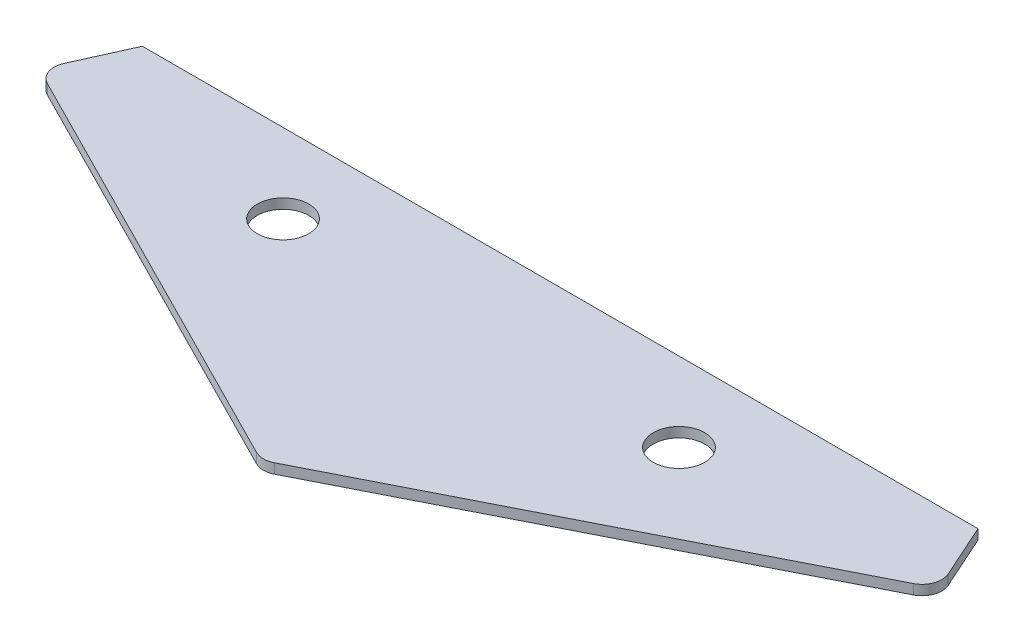
from build123d import *

# Parameters (mm, degrees)
BOSS_EXTRUDE1_DEPTH = 5
SKETCH2_R           = 13
CUT_EXTRUDE1_DEPTH  = 5


with BuildPart() as part:
    # Sketch1 → Boss-Extrude1 (new body)
    with BuildSketch(Plane(origin=(0, 0, 0), x_dir=(1, 0, 0), z_dir=(0, 1, 0))):
        with BuildLine():
            Line((248.032931618, 52.593341059), (260.305567907, 25.2785247))
            ThreePointArc((260.305567907, 25.2785247), (260.612237386, 17.847313664), (255.703480887, 12.259733394))
            Line((255.703480887, 12.259733394), (41.520626689, -96.255259938))
            ThreePointArc((41.520626689, -96.255259938), (37.001121909, -97.334829649), (32.481617129, -96.255259938))
            Line((32.481617129, -96.255259938), (-181.70123707, 12.259733394))
            ThreePointArc((-181.70123707, 12.259733394), (-186.609993569, 17.847313664), (-186.30332409, 25.2785247))
            Line((-186.30332409, 25.2785247), (-174.0306878, 52.593341059))
            Line((-174.0306878, 52.593341059), (248.032931618, 52.593341059))
        make_face()
    extrude(amount=BOSS_EXTRUDE1_DEPTH)

    # Sketch2 → Cut-Extrude1 (cut)
    with BuildSketch(Plane(origin=(0, 5, 0), x_dir=(1, 0, 0), z_dir=(0, 1, 0))):
        with Locations(Location((137.001121909, 12.593341059, 0), (0, 0, 270))):
            Circle(SKETCH2_R)
        with Locations(Location((-62.998878091, 12.593341059, 0), (0, 0, 270))):
            Circle(SKETCH2_R)
    extrude(amount=-CUT_EXTRUDE1_DEPTH, mode=Mode.SUBTRACT)


solid = part.part
